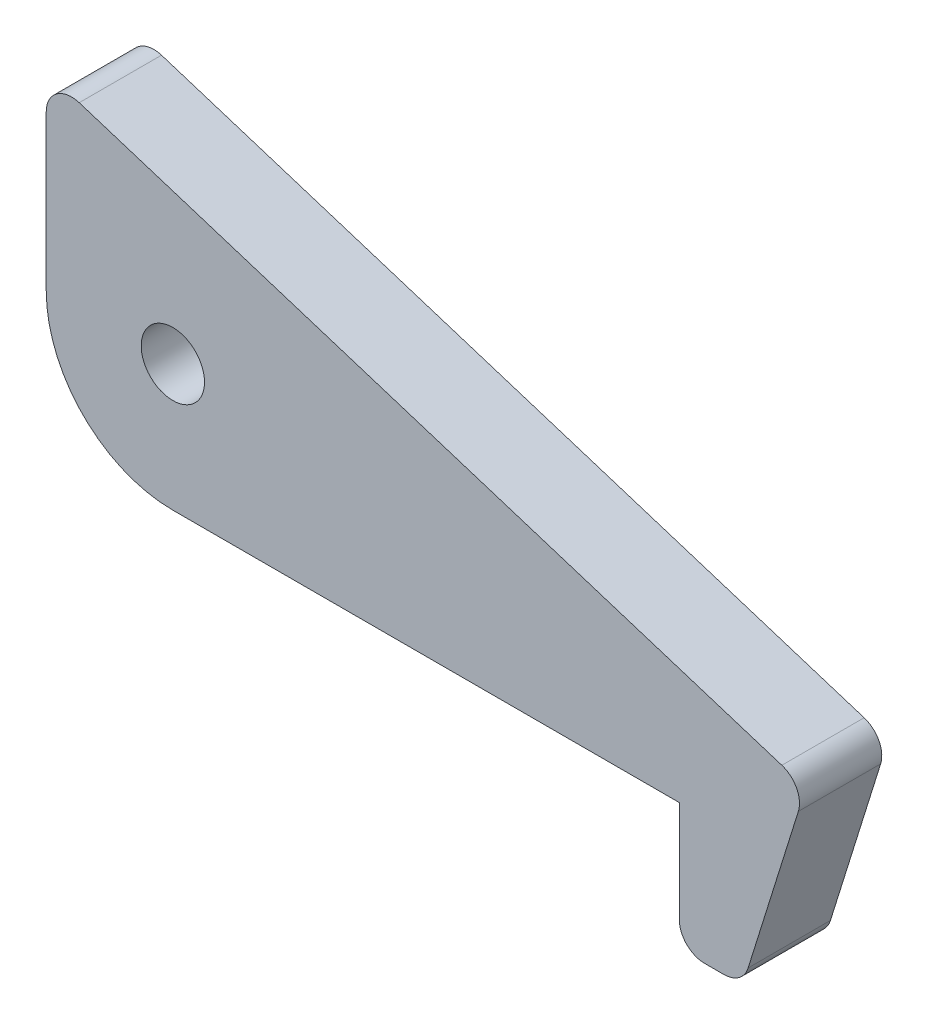
from build123d import *

# Parameters (mm, degrees)
SKETCH1_W           = 60
SKETCH1_H           = 35
BOSS_EXTRUDE1_DEPTH = 6.5
SKETCH2_W           = 50
SKETCH2_H           = 10
CUT_EXTRUDE1_DEPTH  = 70.765679241
FILLET1_R           = 10
CUT_EXTRUDE2_REACH  = 71.766
SKETCH3_R           = 2.5
CUT_EXTRUDE3_DEPTH  = 70.765679241
CUT_EXTRUDE4_DEPTH  = 70.765679241
FILLET6_R           = 2
FILLET7_R           = 2
FILLET8_R           = 2
FILLET9_R           = 2


with BuildPart() as part:
    # Sketch1 → Boss-Extrude1 (new body)
    with BuildSketch(Plane.XY):
        with Locations((30, 17.5)):
            Rectangle(SKETCH1_W, SKETCH1_H)
    extrude(amount=BOSS_EXTRUDE1_DEPTH)

    # Sketch2 → Cut-Extrude1 (cut, through all)
    with BuildSketch(Plane.XY.offset(6.5)):
        with Locations((25, 5)):
            Rectangle(SKETCH2_W, SKETCH2_H)
    extrude(amount=-CUT_EXTRUDE1_DEPTH, mode=Mode.SUBTRACT)

    # Fillet1
    fillet1_edges = [part.edges().sort_by_distance(p)[0] for p in [
        (0, 10, 3.25),
    ]]
    fillet(fillet1_edges, radius=FILLET1_R)

    # Sketch3 → Cut-Extrude2 (cut, up to next)
    with BuildSketch(Plane.XY.offset(6.5), mode=Mode.PRIVATE) as cut_extrude2_sk1:
        with Locations((10, 20)):
            Circle(SKETCH3_R)
    cut_extrude2_tool1 = extrude(cut_extrude2_sk1.sketch, amount=-CUT_EXTRUDE2_REACH, mode=Mode.PRIVATE) & part.part
    add(cut_extrude2_tool1.solids().sort_by_distance((10, 20, 6.5))[0], mode=Mode.SUBTRACT)

    # Sketch4 → Cut-Extrude3 (cut, through all)
    with BuildSketch(Plane.XY.offset(6.5)):
        Polygon((55, 0), (60, 16), (60, 0), align=None)
    extrude(amount=-CUT_EXTRUDE3_DEPTH, mode=Mode.SUBTRACT)

    # Sketch5 → Cut-Extrude4 (cut, through all)
    with BuildSketch(Plane.XY.offset(6.5)):
        Polygon((0, 35), (60, 16), (60, 35), align=None)
    extrude(amount=-CUT_EXTRUDE4_DEPTH, mode=Mode.SUBTRACT)

    # Fillet6
    fillet6_edges = [part.edges().sort_by_distance(p)[0] for p in [
        (50, 0, 3.25),
    ]]
    fillet(fillet6_edges, radius=FILLET6_R)

    # Fillet7
    fillet7_edges = [part.edges().sort_by_distance(p)[0] for p in [
        (55, 0, 3.25),
    ]]
    fillet(fillet7_edges, radius=FILLET7_R)

    # Fillet8
    fillet8_edges = [part.edges().sort_by_distance(p)[0] for p in [
        (60, 16, 3.25),
    ]]
    fillet(fillet8_edges, radius=FILLET8_R)

    # Fillet9
    fillet9_edges = [part.edges().sort_by_distance(p)[0] for p in [
        (0, 35, 3.25),
    ]]
    fillet(fillet9_edges, radius=FILLET9_R)


solid = part.part
